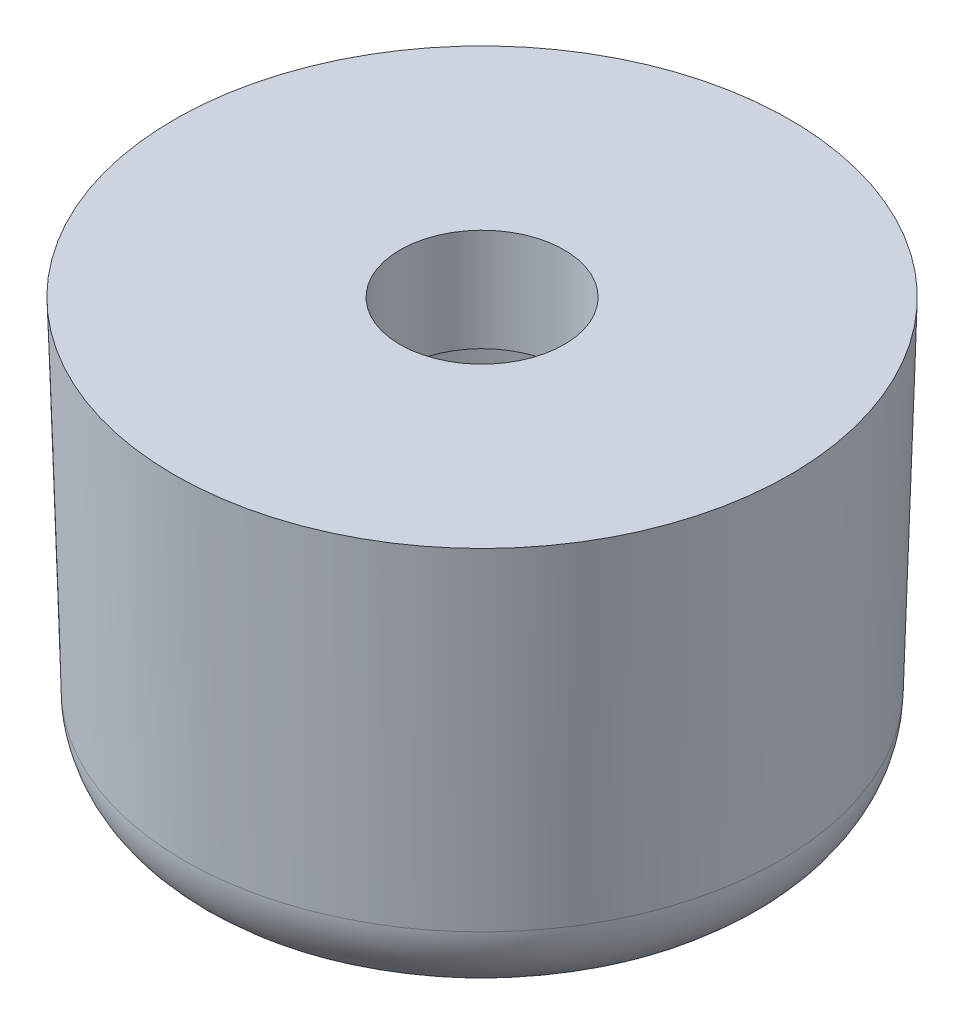
from build123d import *


with BuildPart() as part:
    # Sketch1 → Revolve1 (revolve)
    with BuildSketch(Plane(origin=(0, 0, 0), x_dir=(0, 0, -1), z_dir=(1, 0, 0)), mode=Mode.PRIVATE) as revolve1_sk:
        with BuildLine():
            Line((1.27, 6.477), (4.7625, 6.477))
            Line((4.7625, 6.477), (4.608153951, 1.229234349))
            ThreePointArc((4.608153951, 1.229234349), (4.224499665, 0.357871203), (3.34223409, 0))
            Line((3.34223409, 0), (3.203095817, 4.8895))
            Line((3.203095817, 4.8895), (1.27, 4.8895))
            Line((1.27, 4.8895), (1.27, 6.477))
        make_face()
    revolve(revolve1_sk.sketch.rotate(Axis((0, 6.477, 0), (0, -1, 0)), 180), axis=Axis((0, 6.477, 0), (0, -1, 0)))


solid = part.part
